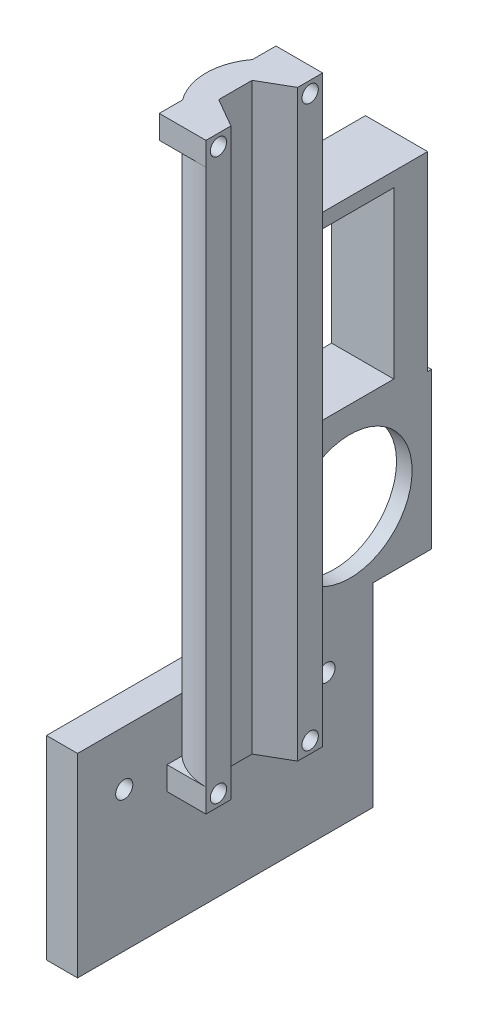
from build123d import *

# Parameters (mm, degrees)
MAIN_BODY_DEPTH                 = 75
SKETCH6_W                       = 38
SKETCH6_H                       = 25
BASE_FIT_PLATE_DEPTH            = 4
SKETCH3_W                       = 3.2102875
SKETCH3_H                       = 3
FRONT_SCREW_HOLES_SUPPORT_DEPTH = 6
FRONT_SCREW_HOLES_REACH         = 79.891
SKETCH4_R                       = 1.05
SKETCH7_W                       = 29
SKETCH7_H                       = 20
SKETCH7_R                       = 8
BUTTON_HOLE_DEPTH               = 2
SKETCH8_W                       = 22
SKETCH8_H                       = 25
SKETCH8_W_2                     = 13.3
SKETCH8_H_2                     = 21.3
SWITCH_HOLE_DEPTH               = 8
SKETCH9_R                       = 1.1
BASE_SCREW_HOLES_DEPTH          = 81.051545894


with BuildPart() as part:
    # Sketch1 → Main Body (new body)
    with BuildSketch(Plane(origin=(0, 0, 0), x_dir=(1, 0, 0), z_dir=(0, 1, 0))):
        with BuildLine():
            Line((0, 4.2897125), (-3.715, 2.14485625))
            Line((-3.715, 2.14485625), (-3.715, -2.14485625))
            Line((-3.715, -2.14485625), (0, -4.2897125))
            Line((0, -4.2897125), (0, -7.5))
            ThreePointArc((0, -7.5), (-7.5, 0), (0, 7.5))
            Line((0, 7.5), (0, 4.2897125))
        make_face()
    extrude(amount=MAIN_BODY_DEPTH)

    # Sketch6 → Base Fit Plate (add)
    with BuildSketch(Plane(origin=(-5, 0, 0), x_dir=(0, 0, -1), z_dir=(1, 0, 0))):
        with Locations((0, -2.5)):
            Rectangle(SKETCH6_W, SKETCH6_H)
    extrude(amount=-BASE_FIT_PLATE_DEPTH)

    # Sketch3 → Front Screw Holes Support (add)
    with BuildSketch(Plane(origin=(0, 0, 0), x_dir=(0, 0, -1), z_dir=(1, 0, 0))):
        with Locations((-5.89485625, 1.5)):
            Rectangle(SKETCH3_W, SKETCH3_H)
        with Locations((-5.89485625, 73.5)):
            Rectangle(SKETCH3_W, SKETCH3_H)
    front_screw_holes_support = extrude(amount=-FRONT_SCREW_HOLES_SUPPORT_DEPTH)

    # Sketch4 → Front Screw Holes (cut, up to next)
    with BuildSketch(Plane(origin=(0, 0, 0), x_dir=(0, 0, -1), z_dir=(1, 0, 0)), mode=Mode.PRIVATE) as front_screw_holes_sk1:
        with Locations((-5.89485625, 73.5)):
            Circle(SKETCH4_R)
    front_screw_holes_tool1 = extrude(front_screw_holes_sk1.sketch, amount=-FRONT_SCREW_HOLES_REACH, mode=Mode.PRIVATE) & part.part
    # Sketch4 → Front Screw Holes (cut, up to next)
    with BuildSketch(Plane(origin=(0, 0, 0), x_dir=(0, 0, -1), z_dir=(1, 0, 0)), mode=Mode.PRIVATE) as front_screw_holes_sk2:
        with Locations((-5.89485625, 1.5)):
            Circle(SKETCH4_R)
    front_screw_holes_tool2 = extrude(front_screw_holes_sk2.sketch, amount=-FRONT_SCREW_HOLES_REACH, mode=Mode.PRIVATE) & part.part
    front_screw_holes_1 = front_screw_holes_tool1.solids().sort_by_distance((0, 73.5, 5.894856))[0]
    add(front_screw_holes_1, mode=Mode.SUBTRACT)
    front_screw_holes_2 = front_screw_holes_tool2.solids().sort_by_distance((0, 1.5, 5.894856))[0]
    add(front_screw_holes_2, mode=Mode.SUBTRACT)
    front_screw_holes = front_screw_holes_1 + front_screw_holes_2  # Front Screw Holes as one shape, for the pattern or mirror that repeats it

    # Back Screw Holes and Support: Front Screw Holes Support, Front Screw Holes across plane
    add(front_screw_holes_support.mirror(Plane.XY))
    add(front_screw_holes.mirror(Plane.XY), mode=Mode.SUBTRACT)

    # Sketch7 → Button Hole (add)
    with BuildSketch(Plane(origin=(-5, 0, 0), x_dir=(0, 0, -1), z_dir=(1, 0, 0))):
        with Locations((12, 20)):
            Rectangle(SKETCH7_W, SKETCH7_H)
        with Locations((16, 20)):
            Circle(SKETCH7_R, mode=Mode.SUBTRACT)
    extrude(amount=-BUTTON_HOLE_DEPTH)

    # Sketch8 → Switch Hole (add)
    with BuildSketch(Plane(origin=(-5, 0, 0), x_dir=(0, 0, -1), z_dir=(1, 0, 0))):
        with Locations((15, 42)):
            Rectangle(SKETCH8_W, SKETCH8_H)
        with Locations((15, 42)):
            Rectangle(SKETCH8_W_2, SKETCH8_H_2, mode=Mode.SUBTRACT)
    extrude(amount=-SWITCH_HOLE_DEPTH)

    # Sketch9 → Base Screw Holes (cut, through all)
    with BuildSketch(Plane.ZY.offset(9)):
        with Locations((-13, 3)):
            Circle(SKETCH9_R)
        with Locations((13, 3)):
            Circle(SKETCH9_R)
    extrude(amount=-BASE_SCREW_HOLES_DEPTH, mode=Mode.SUBTRACT)


solid = part.part
